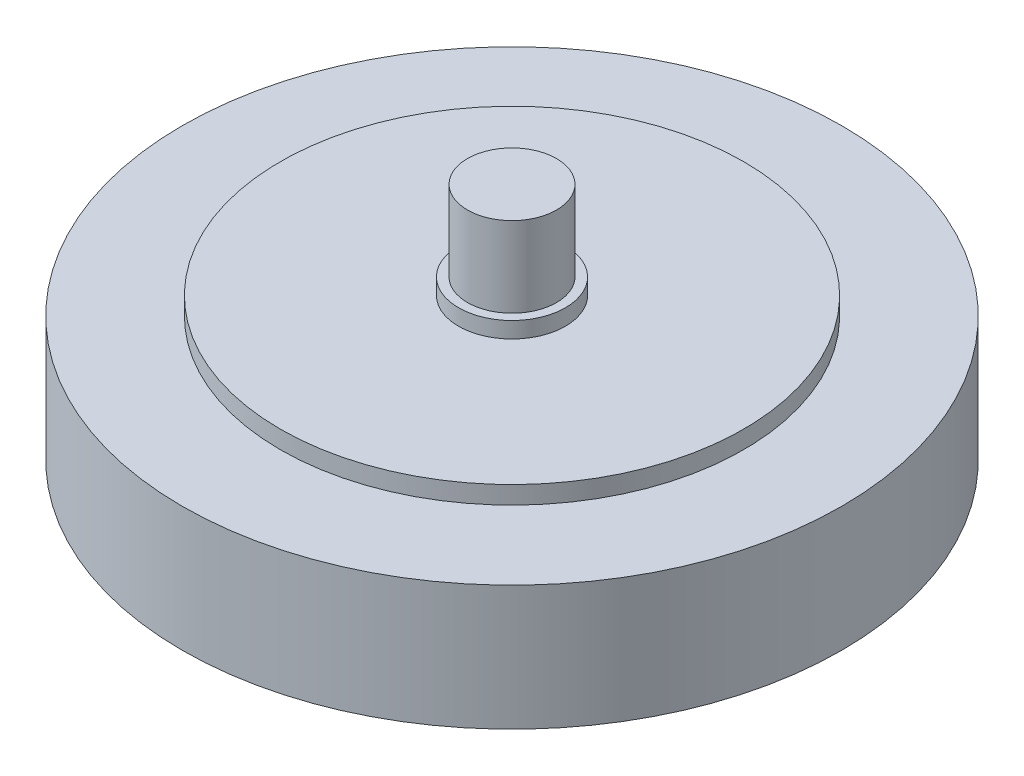
from build123d import *


with BuildPart() as part:
    # Sketch1 → Revolve1 (revolve)
    with BuildSketch(Plane.XY, mode=Mode.PRIVATE) as revolve1_sk:
        Polygon((0, 0), (18.5, 0), (18.5, 7), (13, 7), (13, 8), (3, 8), (3, 8.9), (2.5, 8.9), (2.5, 13.4), (0, 13.4), align=None)
    revolve(revolve1_sk.sketch.rotate(Axis((0, 0, 0), (0, 1, 0)), 90), axis=Axis((0, 0, 0), (0, 1, 0)))


solid = part.part
